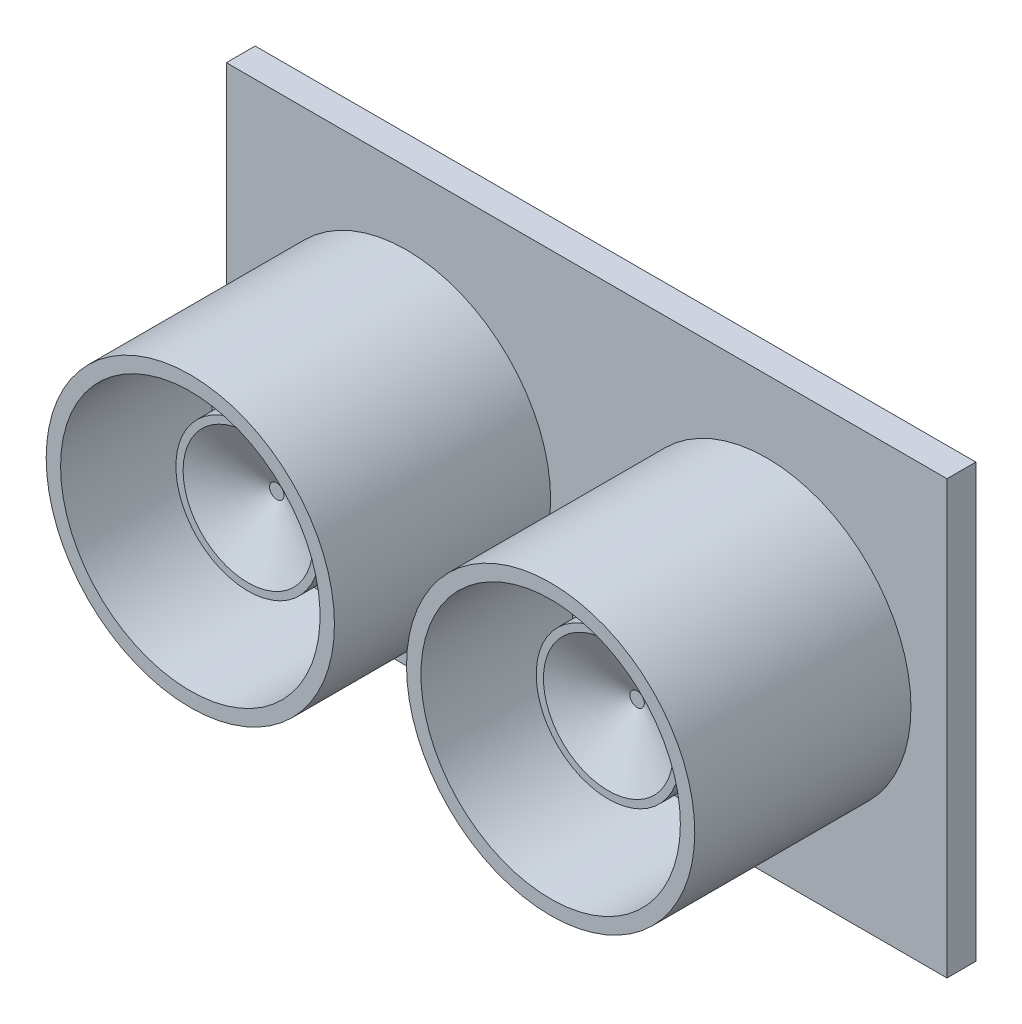
from build123d import *

# Parameters (mm, degrees)
SKETCH_1_W      = 50
SKETCH_1_H      = 30
EXTRUDE_1_DEPTH = 2
SKETCH_2_R      = 10
SKETCH_2_R_2    = 9
EXTRUDE_2_DEPTH = 15
SKETCH_3_R      = 7.5
EXTRUDE_3_DEPTH = 6
SKETCH_4_R      = 5
EXTRUDE_4_DEPTH = 5


with BuildPart() as part:
    # 草图1 → 凸台-拉伸1 (new body)
    with BuildSketch(Plane.XY):
        Rectangle(SKETCH_1_W, SKETCH_1_H)
    extrude(amount=EXTRUDE_1_DEPTH)

    # 草图2 → 凸台-拉伸2 (add)
    # profile 1 of 2: a face of its own
    with BuildSketch(Plane.XY.offset(2)):
        with Locations(Location((12.5, 0, 0), (0, 0, 180))):
            Circle(SKETCH_2_R)
        with Locations((12.5, 0)):
            Circle(SKETCH_2_R_2, mode=Mode.SUBTRACT)
    # profile 2 of 2: a face of its own
    with BuildSketch(Plane.XY.offset(2)):
        with Locations(Location((-12.5, 0, 0), (0, 0, 180))):
            Circle(SKETCH_2_R)
        with Locations(Location((-12.5, 0, 0), (0, 0, 180))):
            Circle(SKETCH_2_R_2, mode=Mode.SUBTRACT)
    extrude(amount=EXTRUDE_2_DEPTH)

    # 草图3 → 凸台-拉伸3 (add)
    with BuildSketch(Plane.XY.offset(2)):
        with Locations(Location((12.5, 0, 0), (0, 0, 180))):
            Circle(SKETCH_3_R)
        with Locations(Location((-12.5, 0, 0), (0, 0, 180))):
            Circle(SKETCH_3_R)
    extrude(amount=EXTRUDE_3_DEPTH)

    # 草图4 → 凸台-拉伸4 (add)
    with BuildSketch(Plane.XY.offset(8)):
        with Locations((-12.5, 0)):
            Circle(SKETCH_4_R)
        with Locations((12.5, 0)):
            Circle(SKETCH_4_R)
    extrude(amount=EXTRUDE_4_DEPTH)

    # 草图5 → 切除-旋转1 (revolve, cut)
    with BuildSketch(Plane(origin=(0, 0, 0), x_dir=(1, 0, 0), z_dir=(0, 1, 0))):
        Polygon((12.5, -13), (17, -13), (13, -11), (12.5, -11), align=None)
    cut_revolve_1 = revolve(axis=Axis((12.5, 0, 14.465329718), (0, 0, -1)), mode=Mode.SUBTRACT)

    # 镜向1: 切除-旋转1 across plane
    add(cut_revolve_1.mirror(Plane(origin=(0, 0, 0), x_dir=(0, 0, 1), z_dir=(1, 0, 0))), mode=Mode.SUBTRACT)


solid = part.part
